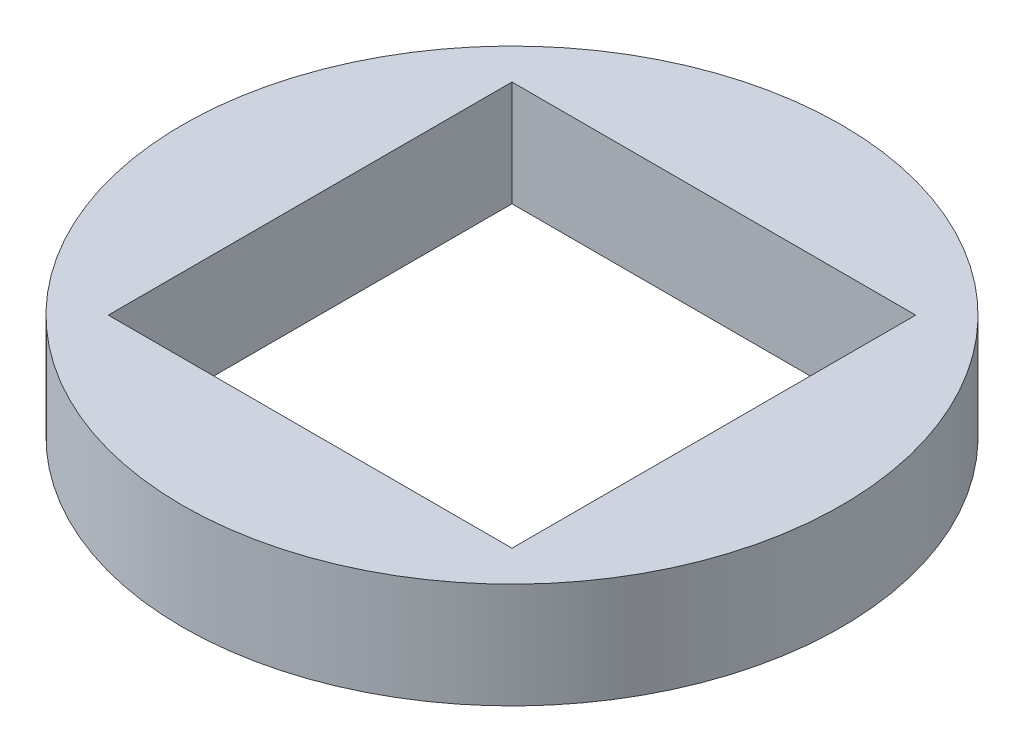
from build123d import *

# Parameters (mm, degrees)
SKETCH1_R           = 7.9375
SKETCH1_W           = 9.7234375
SKETCH1_H           = 9.7234375
BOSS_EXTRUDE1_DEPTH = 2.54


with BuildPart() as part:
    # Sketch1 → Boss-Extrude1 (new body)
    with BuildSketch(Plane(origin=(0, 0, 0), x_dir=(1, 0, 0), z_dir=(0, 1, 0))):
        with Locations(Location((0, 0, 0), (0, 0, 270))):
            Circle(SKETCH1_R)
        Rectangle(SKETCH1_W, SKETCH1_H, mode=Mode.SUBTRACT)
    extrude(amount=BOSS_EXTRUDE1_DEPTH)


solid = part.part
